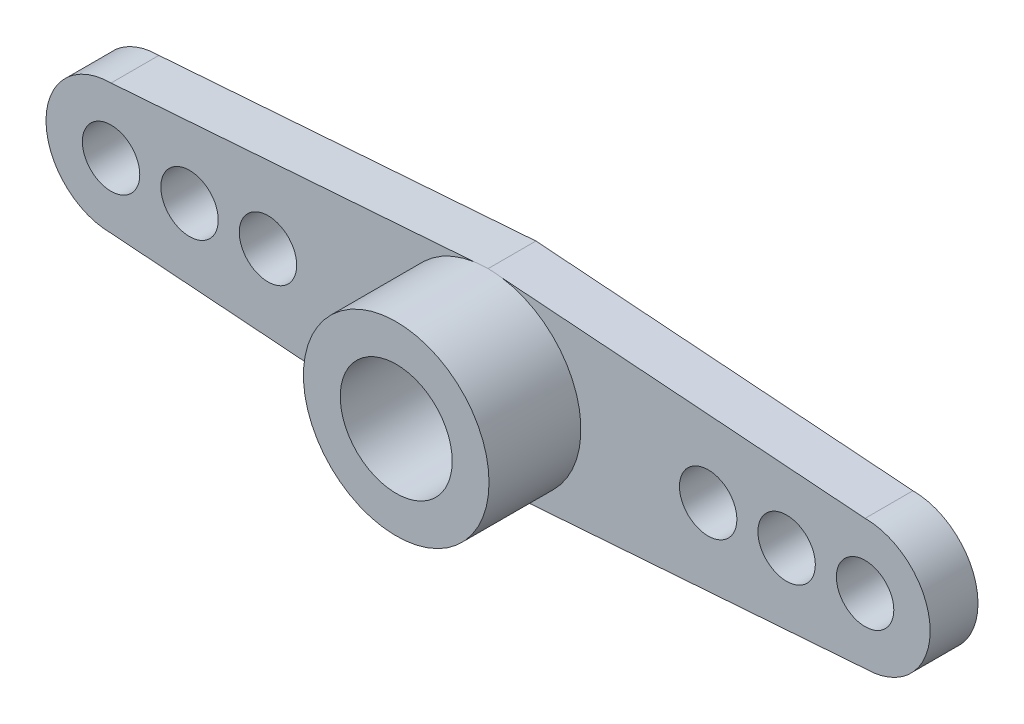
from build123d import *

# Parameters (mm, degrees)
SKETCH_1_R          = 1.5
SKETCH_1_R_2        = 3
EXTRUDE_1_DEPTH     = 2.5
SKETCH_2_R          = 4.85
EXTRUDE_2_DEPTH     = 4.8
SKETCH_3_R          = 2.925
CUT_EXTRUDE_1_DEPTH = 4.5
SKETCH_4_R          = 1.5
CUT_EXTRUDE_2_DEPTH = 4.5


with BuildPart() as part:
    # 草图1 → 凸台-拉伸1 (new body)
    # profile 1 of 3: a face of its own
    with BuildSketch(Plane.XY):
        with BuildLine():
            Line((-0.710112316, 4.79773285), (-19.7, 3.4))
            ThreePointArc((-19.7, 3.4), (-23.1, 0), (-19.7, -3.4))
            Line((-19.7, -3.4), (-0.710112316, -4.79773285))
            ThreePointArc((-0.710112316, -4.79773285), (-4.85, 0), (-0.710112316, 4.79773285))
        make_face()
        with Locations((-19.7, 0)):
            Circle(SKETCH_1_R, mode=Mode.SUBTRACT)
        with Locations((-15.6, 0)):
            Circle(SKETCH_1_R, mode=Mode.SUBTRACT)
        with Locations((-11.5, 0)):
            Circle(SKETCH_1_R, mode=Mode.SUBTRACT)
    # profile 2 of 3: a face of its own
    with BuildSketch(Plane.XY):
        with BuildLine():
            Line((19.7, 3.4), (0.710112316, 4.79773285))
            ThreePointArc((0.710112316, 4.79773285), (3.671957566, 3.168474023), (4.85, 0))
            ThreePointArc((4.85, 0), (3.671957566, -3.168474023), (0.710112316, -4.79773285))
            Line((0.710112316, -4.79773285), (19.7, -3.4))
            ThreePointArc((19.7, -3.4), (23.1, 0), (19.7, 3.4))
        make_face()
        with Locations((11.5, 0)):
            Circle(SKETCH_1_R, mode=Mode.SUBTRACT)
        with Locations((15.6, 0)):
            Circle(SKETCH_1_R, mode=Mode.SUBTRACT)
        with Locations((19.7, 0)):
            Circle(SKETCH_1_R, mode=Mode.SUBTRACT)
    # profile 3 of 3: a face of its own
    with BuildSketch(Plane.XY):
        with BuildLine():
            Line((0, 4.85), (-0.710112316, 4.79773285))
            ThreePointArc((-0.710112316, 4.79773285), (-4.85, 0), (-0.710112316, -4.79773285))
            Line((-0.710112316, -4.79773285), (0, -4.85))
            Line((0, -4.85), (0.710112316, -4.79773285))
            ThreePointArc((0.710112316, -4.79773285), (3.671957566, -3.168474023), (4.85, 0))
            ThreePointArc((4.85, 0), (3.671957566, 3.168474023), (0.710112316, 4.79773285))
            Line((0.710112316, 4.79773285), (0, 4.85))
        make_face()
        Circle(SKETCH_1_R_2, mode=Mode.SUBTRACT)
    extrude(amount=EXTRUDE_1_DEPTH)

    # 草图2 → 凸台-拉伸2 (add)
    with BuildSketch(Plane.XY.offset(2.5)):
        with Locations(Location((0, 0, 0), (0, 0, 98.419222119))):
            Circle(SKETCH_2_R)
    extrude(amount=EXTRUDE_2_DEPTH)

    # 草图3 → 切除-拉伸1 (cut)
    with BuildSketch(Plane.XY.offset(7.3)):
        Circle(SKETCH_3_R)
    extrude(amount=-CUT_EXTRUDE_1_DEPTH, mode=Mode.SUBTRACT)

    # 草图4 → 切除-拉伸2 (cut)
    with BuildSketch(Plane(origin=(0, 0, 2.5), x_dir=(-1, 0, 0), z_dir=(0, 0, -1))):
        Circle(SKETCH_4_R)
    extrude(amount=-CUT_EXTRUDE_2_DEPTH, mode=Mode.SUBTRACT)


solid = part.part
